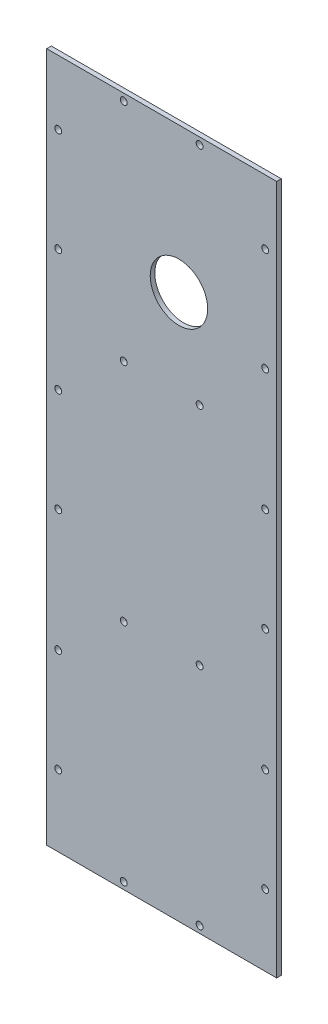
from build123d import *

# Parameters (mm, degrees)
SKETCH1_W           = 100
SKETCH1_H           = 300
BOSS_EXTRUDE1_DEPTH = 2
SKETCH2_R           = 1.5
CUT_EXTRUDE1_DEPTH  = 10
SKETCH3_R           = 12.5
CUT_EXTRUDE2_DEPTH  = 10


with BuildPart() as part:
    # Sketch1 → Boss-Extrude1 (new body)
    with BuildSketch(Plane.XY):
        Rectangle(SKETCH1_W, SKETCH1_H)
    extrude(amount=BOSS_EXTRUDE1_DEPTH)

    # Sketch2 → Cut-Extrude1 (cut)
    with BuildSketch(Plane.XY.offset(2)):
        with Locations((-45, 122)):
            Circle(SKETCH2_R)
        with Locations((-45, 77)):
            Circle(SKETCH2_R)
        with Locations((45, 122)):
            Circle(SKETCH2_R)
        with Locations((45, 77)):
            Circle(SKETCH2_R)
        with Locations((-45, 24)):
            Circle(SKETCH2_R)
        with Locations((-45, -21)):
            Circle(SKETCH2_R)
        with Locations((45, 24)):
            Circle(SKETCH2_R)
        with Locations((45, -21)):
            Circle(SKETCH2_R)
        with Locations((-45, -74)):
            Circle(SKETCH2_R)
        with Locations((-45, -119)):
            Circle(SKETCH2_R)
        with Locations((45, -74)):
            Circle(SKETCH2_R)
        with Locations((45, -119)):
            Circle(SKETCH2_R)
        with Locations((16.5, -147)):
            Circle(SKETCH2_R)
        with Locations((-16.5, -147)):
            Circle(SKETCH2_R)
        with Locations((-16.5, -49)):
            Circle(SKETCH2_R)
        with Locations((16.5, -49)):
            Circle(SKETCH2_R)
        with Locations((-16.5, 49)):
            Circle(SKETCH2_R)
        with Locations((16.5, 49)):
            Circle(SKETCH2_R)
        with Locations((-16.5, 147)):
            Circle(SKETCH2_R)
        with Locations((16.5, 147)):
            Circle(SKETCH2_R)
    extrude(amount=-CUT_EXTRUDE1_DEPTH, mode=Mode.SUBTRACT)

    # Sketch3 → Cut-Extrude2 (cut)
    with BuildSketch(Plane(origin=(0, 0, 0), x_dir=(-1, 0, 0), z_dir=(0, 0, -1))):
        with Locations((-7.5, 87)):
            Circle(SKETCH3_R)
    extrude(amount=-CUT_EXTRUDE2_DEPTH, mode=Mode.SUBTRACT)


solid = part.part
